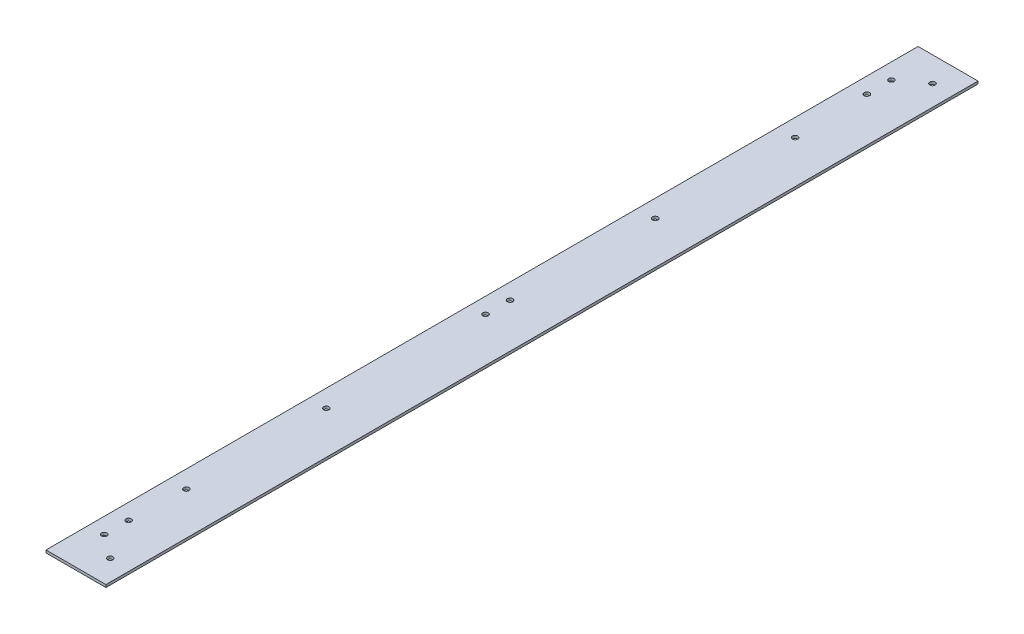
from build123d import *

# Parameters (mm, degrees)
CROQUIS1_W              = 35
CROQUIS1_H              = 500
SALIENTE_EXTRUIR1_DEPTH = 1.5
CROQUIS2_R              = 1.55
CORTAR_EXTRUIR1_DEPTH   = 1.5
CROQUIS3_R              = 1.55
CORTAR_EXTRUIR2_DEPTH   = 1.5
CROQUIS5_R              = 1.55
CORTAR_EXTRUIR3_DEPTH   = 1.5
CROQUIS6_OUTSIDE_W      = 137.246
CROQUIS6_OUTSIDE_H      = 602.246
CROQUIS6_OUTSIDE_W_2    = 33.5
CROQUIS6_OUTSIDE_H_2    = 498.5
CORTAR_EXTRUIR4_DEPTH   = 1.5
CROQUIS7_W              = 0.75
CROQUIS7_H              = 498.5
SALIENTE_EXTRUIR2_DEPTH = 1.5


with BuildPart() as part:
    # Croquis1 → Saliente-Extruir1 (new body)
    with BuildSketch(Plane(origin=(0, 0, 0), x_dir=(1, 0, 0), z_dir=(0, 1, 0))):
        with Locations((17.5, -250)):
            Rectangle(CROQUIS1_W, CROQUIS1_H)
    extrude(amount=SALIENTE_EXTRUIR1_DEPTH)

    # Croquis2 → Cortar-Extruir1 (cut)
    with BuildSketch(Plane(origin=(0, 1.5, 0), x_dir=(1, 0, 0), z_dir=(0, 1, 0))):
        with Locations(Location((22.5, -15, 0), (0, 0, 270))):
            Circle(CROQUIS2_R)
        with Locations(Location((22.5, -485, 0), (0, 0, 270))):
            Circle(CROQUIS2_R)
    extrude(amount=-CORTAR_EXTRUIR1_DEPTH, mode=Mode.SUBTRACT)

    # Croquis3 → Cortar-Extruir2 (cut)
    with BuildSketch(Plane(origin=(0, 1.5, 0), x_dir=(1, 0, 0), z_dir=(0, 1, 0))):
        with Locations(Location((9, -25, 0), (0, 0, 270))):
            Circle(CROQUIS3_R)
        with Locations(Location((9, -39, 0), (0, 0, 270))):
            Circle(CROQUIS3_R)
        with Locations(Location((9, -475, 0), (0, 0, 270))):
            Circle(CROQUIS3_R)
        with Locations(Location((9, -461, 0), (0, 0, 270))):
            Circle(CROQUIS3_R)
        with Locations(Location((9, -243, 0), (0, 0, 270))):
            Circle(CROQUIS3_R)
        with Locations(Location((9, -257, 0), (0, 0, 270))):
            Circle(CROQUIS3_R)
    extrude(amount=-CORTAR_EXTRUIR2_DEPTH, mode=Mode.SUBTRACT)

    # Croquis5 → Cortar-Extruir3 (cut)
    with BuildSketch(Plane(origin=(0, 1.5, 0), x_dir=(1, 0, 0), z_dir=(0, 1, 0))):
        with Locations(Location((10, -81, 0), (0, 0, 270))):
            Circle(CROQUIS5_R)
        with Locations(Location((10, -161, 0), (0, 0, 270))):
            Circle(CROQUIS5_R)
        with Locations(Location((10, -349, 0), (0, 0, 270))):
            Circle(CROQUIS5_R)
        with Locations(Location((10, -429, 0), (0, 0, 270))):
            Circle(CROQUIS5_R)
    extrude(amount=-CORTAR_EXTRUIR3_DEPTH, mode=Mode.SUBTRACT)

    # Croquis6 outside → Cortar-Extruir4 (cut)
    with BuildSketch(Plane(origin=(0, 1.5, 0), x_dir=(1, 0, 0), z_dir=(0, 1, 0))):
        with Locations((17.5, -250)):
            Rectangle(CROQUIS6_OUTSIDE_W, CROQUIS6_OUTSIDE_H)
        with Locations((17.5, -250)):
            Rectangle(CROQUIS6_OUTSIDE_W_2, CROQUIS6_OUTSIDE_H_2, mode=Mode.SUBTRACT)
    extrude(amount=-CORTAR_EXTRUIR4_DEPTH, mode=Mode.SUBTRACT)

    # Croquis7 → Saliente-Extruir2 (add)
    with BuildSketch(Plane(origin=(0, 1.5, 0), x_dir=(1, 0, 0), z_dir=(0, 1, 0))):
        with Locations((0.375, -250)):
            Rectangle(CROQUIS7_W, CROQUIS7_H)
    extrude(amount=-SALIENTE_EXTRUIR2_DEPTH)


solid = part.part
